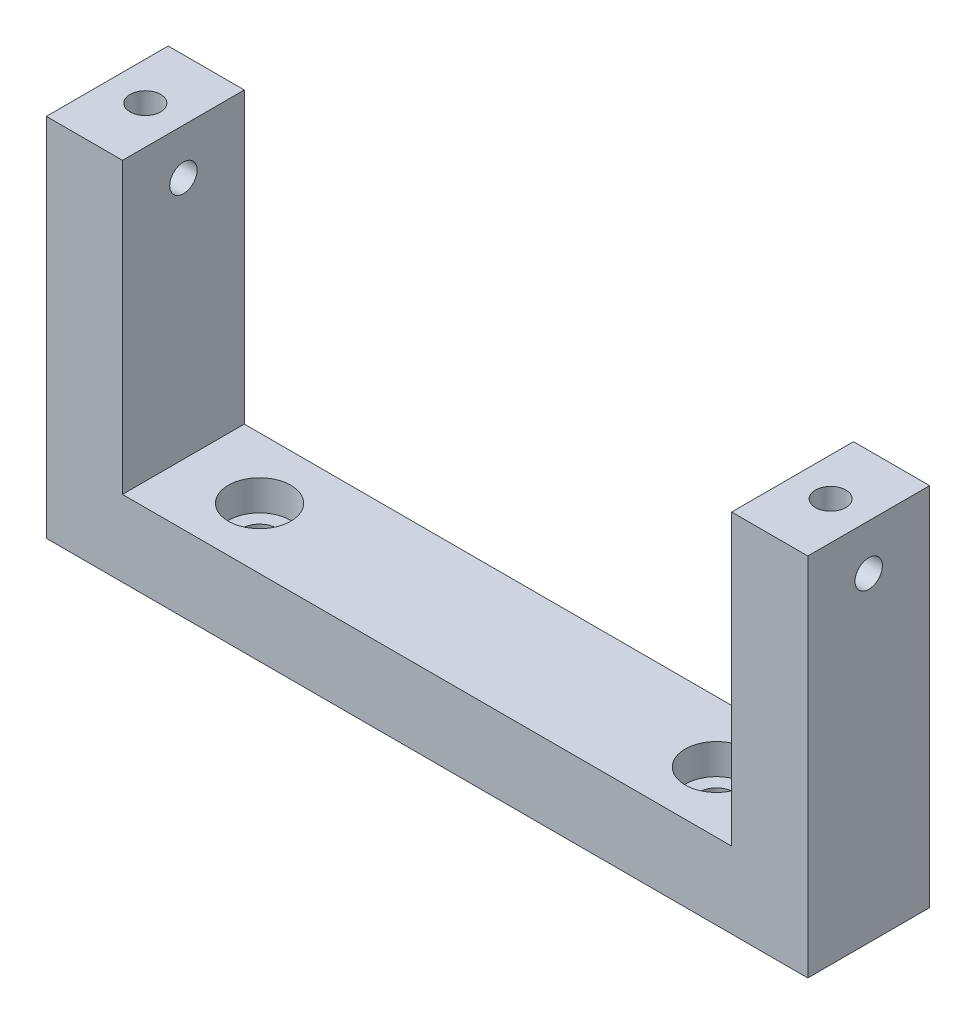
from build123d import *

# Parameters (mm, degrees)
SKETCH1_W           = 50
SKETCH1_H           = 8
BOSS_EXTRUDE1_DEPTH = 5
SKETCH5_W           = 8
SKETCH5_H           = 24
SKETCH5_R           = 0.9
BOSS_EXTRUDE3_DEPTH = 5
CUT_EXTRUDE3_REACH  = 36.886
SKETCH6_R           = 1
SKETCH2_R           = 1.15
CUT_EXTRUDE1_DEPTH  = 35.885527225
CUT_EXTRUDE4_REACH  = 39.886
CUT_EXTRUDE4_START  = -3
SKETCH7_R           = 2.05


with BuildPart() as part:
    # Sketch1 → Boss-Extrude1 (new body)
    with BuildSketch(Plane(origin=(0, 0, 0), x_dir=(1, 0, 0), z_dir=(0, 1, 0))):
        Rectangle(SKETCH1_W, SKETCH1_H)
    extrude(amount=BOSS_EXTRUDE1_DEPTH)

    # Sketch5 → Boss-Extrude3 (add)
    with BuildSketch(Plane(origin=(25, 0, 0), x_dir=(0, 0, -1), z_dir=(1, 0, 0))):
        with Locations((0, 12)):
            Rectangle(SKETCH5_W, SKETCH5_H)
        with Locations((0, 21)):
            Circle(SKETCH5_R, mode=Mode.SUBTRACT)
    boss_extrude3 = extrude(amount=-BOSS_EXTRUDE3_DEPTH)

    # Sketch6 → Cut-Extrude3 (cut, up to next)
    with BuildSketch(Plane(origin=(0, 24, 0), x_dir=(1, 0, 0), z_dir=(0, 1, 0)), mode=Mode.PRIVATE) as cut_extrude3_sk1:
        with Locations(Location((22.5, 0, 0), (0, 0, 270))):
            Circle(SKETCH6_R)
    cut_extrude3_tool1 = extrude(cut_extrude3_sk1.sketch, amount=-CUT_EXTRUDE3_REACH, mode=Mode.PRIVATE) & part.part
    cut_extrude3 = cut_extrude3_tool1.solids().sort_by_distance((22.5, 24, 0))[0]
    add(cut_extrude3, mode=Mode.SUBTRACT)

    # Sketch2 → Cut-Extrude1 (cut, through all)
    with BuildSketch(Plane(origin=(0, 0, 0), x_dir=(1, 0, 0), z_dir=(0, 1, 0))):
        with Locations(Location((15, 0, 0), (0, 0, 90))):
            Circle(SKETCH2_R)
    cut_extrude1 = extrude(amount=CUT_EXTRUDE1_DEPTH, mode=Mode.SUBTRACT)

    # Sketch7 → Cut-Extrude4 (cut, up to next)
    with BuildSketch(Plane.XZ.offset(CUT_EXTRUDE4_START), mode=Mode.PRIVATE) as cut_extrude4_sk1:
        with Locations(Location((15, 0, 0), (0, 0, 270))):
            Circle(SKETCH7_R)
    cut_extrude4_tool1 = extrude(cut_extrude4_sk1.sketch, amount=-CUT_EXTRUDE4_REACH, mode=Mode.PRIVATE) & part.part
    cut_extrude4 = cut_extrude4_tool1.solids().sort_by_distance((15, 3, 0))[0]
    add(cut_extrude4, mode=Mode.SUBTRACT)

    # Mirror5: Boss-Extrude3, Cut-Extrude3, Cut-Extrude1, Cut-Extrude4 across plane
    add(boss_extrude3.mirror(Plane(origin=(0, 0, 0), x_dir=(0, 0, 1), z_dir=(1, 0, 0))))
    add(cut_extrude3.mirror(Plane(origin=(0, 0, 0), x_dir=(0, 0, 1), z_dir=(1, 0, 0))), mode=Mode.SUBTRACT)
    add(cut_extrude1.mirror(Plane(origin=(0, 0, 0), x_dir=(0, 0, 1), z_dir=(1, 0, 0))), mode=Mode.SUBTRACT)
    add(cut_extrude4.mirror(Plane(origin=(0, 0, 0), x_dir=(0, 0, 1), z_dir=(1, 0, 0))), mode=Mode.SUBTRACT)


solid = part.part
